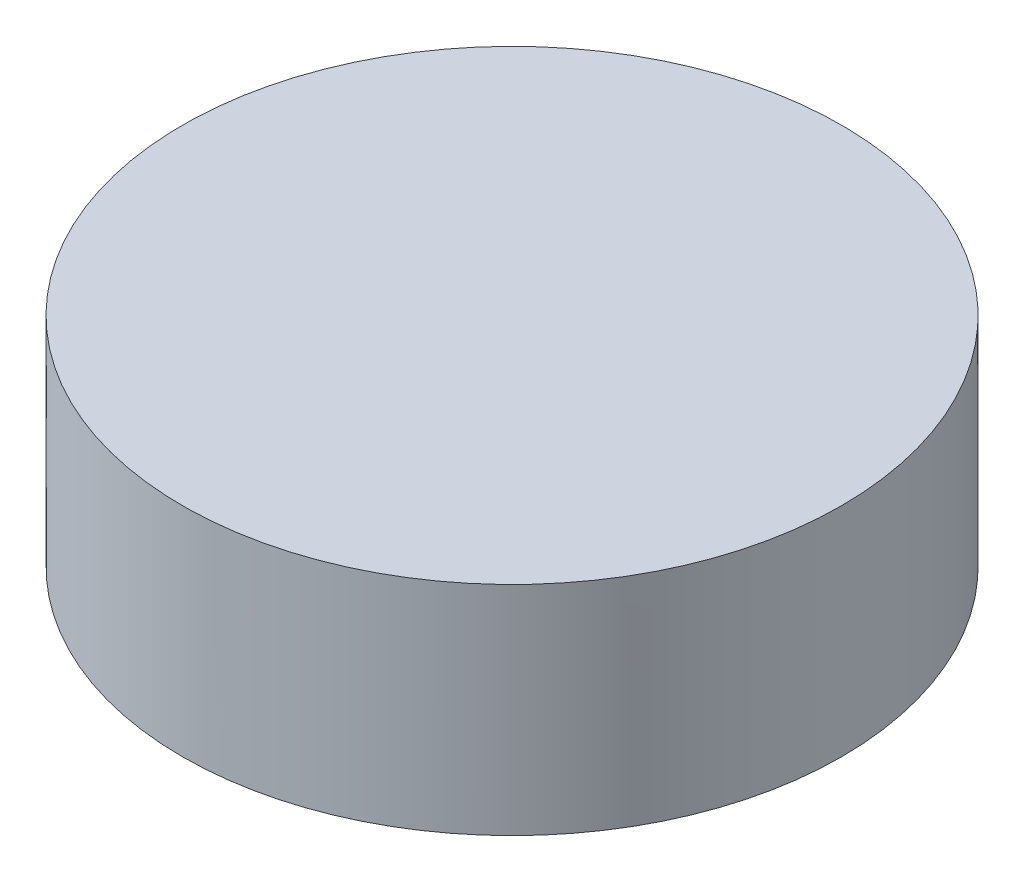
from build123d import *

# Parameters (mm, degrees)
SKETCH_1_R      = 15
EXTRUDE_1_DEPTH = 9.9


with BuildPart() as part:
    # Эскиз1 → Вытянуть1 (new body)
    with BuildSketch(Plane(origin=(0, 0, 0), x_dir=(1, 0, 0), z_dir=(0, 1, 0))):
        Circle(SKETCH_1_R)
    extrude(amount=EXTRUDE_1_DEPTH)


solid = part.part
